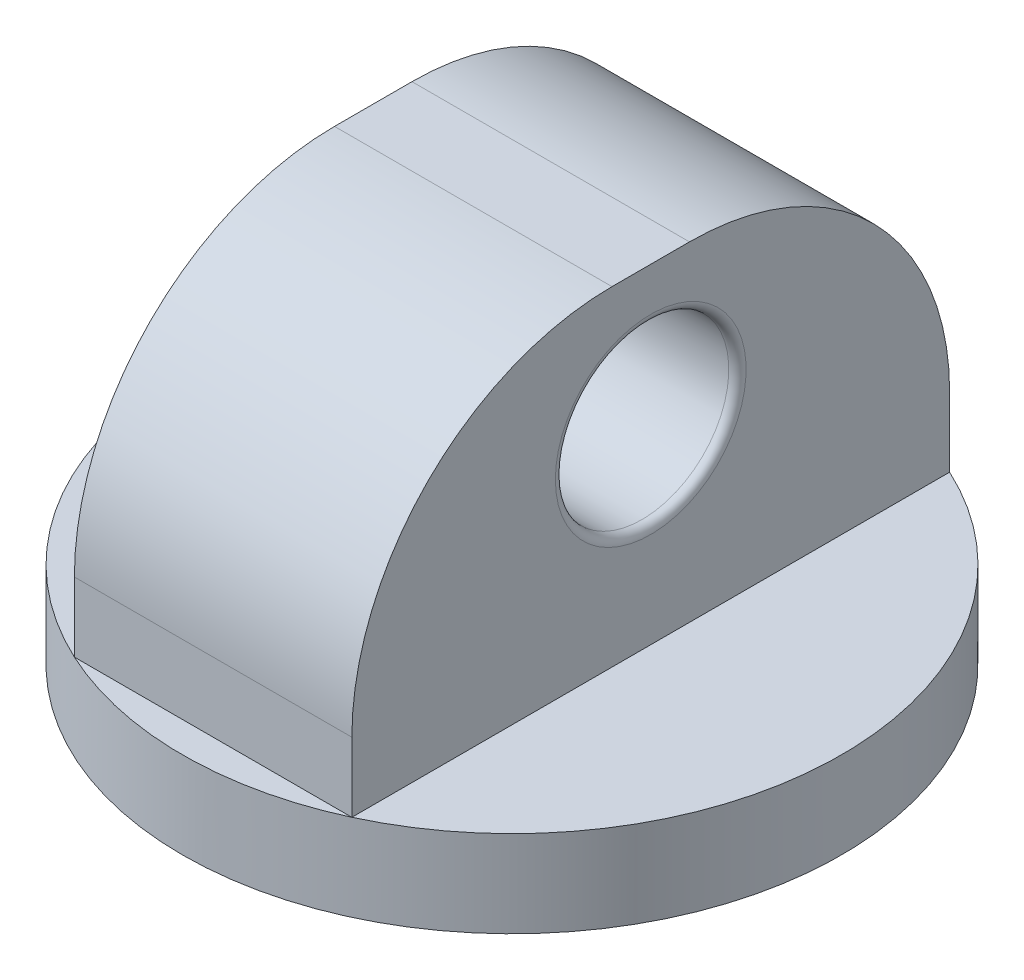
from build123d import *

# Parameters (mm, degrees)
SKETCH1_R               = 38
BOSS_EXTRUDE1_DEPTH     = 10
SKETCH2_W               = 32
SKETCH2_H               = 68.934751758
BOSS_EXTRUDE2_DEPTH     = 38
CUT_EXTRUDE1_DEPTH      = 38
CUT_EXTRUDE1_DEPTH_BACK = 38
SKETCH3_R               = 10
FILLET3_R               = 30
FILLET6_R               = 1


with BuildPart() as part:
    # Sketch1 → Boss-Extrude1 (new body)
    with BuildSketch(Plane(origin=(0, 0, 0), x_dir=(1, 0, 0), z_dir=(0, 1, 0))):
        with Locations(Location((0, 0, 0), (0, 0, 270))):
            Circle(SKETCH1_R)
    extrude(amount=BOSS_EXTRUDE1_DEPTH)

    # Sketch2 → Boss-Extrude2 (add)
    with BuildSketch(Plane(origin=(0, 10, 0), x_dir=(1, 0, 0), z_dir=(0, 1, 0))):
        Rectangle(SKETCH2_W, SKETCH2_H)
    extrude(amount=BOSS_EXTRUDE2_DEPTH)

    # Sketch3 → Cut-Extrude1 (cut, two sides: drawn at the far end of the back side and taken through both)
    with BuildSketch(Plane(origin=(0, 0, 0), x_dir=(0, 0, -1), z_dir=(1, 0, 0)).offset(-CUT_EXTRUDE1_DEPTH_BACK)):
        with Locations(Location((0, 32, 0), (0, 0, 180))):
            Circle(SKETCH3_R)
    extrude(amount=CUT_EXTRUDE1_DEPTH + CUT_EXTRUDE1_DEPTH_BACK, mode=Mode.SUBTRACT)

    # Fillet3
    fillet3_edges = [part.edges().sort_by_distance(p)[0] for p in [
        (0, 48, -34.467375879),
        (0, 48, 34.467375879),
    ]]
    fillet(fillet3_edges, radius=FILLET3_R)

    # Fillet6
    fillet6_edges = [part.edges().sort_by_distance(p)[0] for p in [
        (16, 32, -10),
        (-16, 32, -10),
    ]]
    fillet(fillet6_edges, radius=FILLET6_R)


solid = part.part
